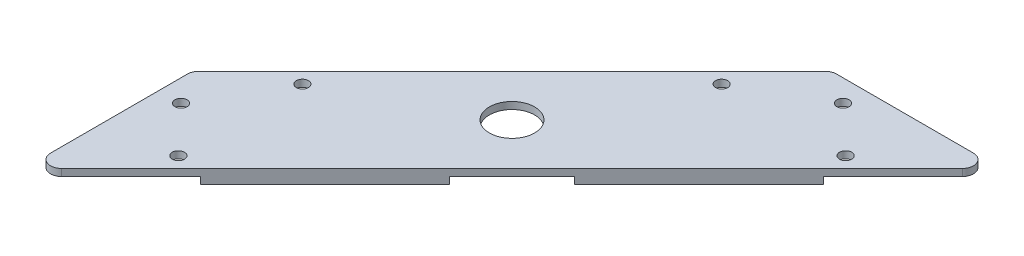
from build123d import *

# Parameters (mm, degrees)
SKETCH1_R           = 10.25
BOSS_EXTRUDE1_DEPTH = 3.175
BOSS_EXTRUDE2_DEPTH = 3.175
FILLET1_R           = 5
CUT_EXTRUDE1_REACH  = 260.624
SKETCH3_R           = 2.75


with BuildPart() as part:
    # Sketch1 → Boss-Extrude1 (new body)
    with BuildSketch(Plane(origin=(0, 0, 0), x_dir=(1, 0, 0), z_dir=(0, 1, 0))):
        Polygon((0, 0), (76.2, 0), (-145, -221.2), (-145, -145), align=None)
        with Locations(Location((-53.45, -91.55, 0), (0, 0, 270))):
            Circle(SKETCH1_R, mode=Mode.SUBTRACT)
    extrude(amount=BOSS_EXTRUDE1_DEPTH)

    # Sketch2 → Boss-Extrude2 (add)
    with BuildSketch(Plane.XZ):
        Polygon((-20.257864376, 96.457864376), (-58.357864376, 58.357864376), (-40, 40), (36.2, 40), align=None)
        Polygon((-105, 105), (-86.642135624, 86.642135624), (-48.542135624, 124.742135624), (-105, 181.2), align=None)
    extrude(amount=BOSS_EXTRUDE2_DEPTH)

    # Fillet1
    fillet1_edges = [part.edges().sort_by_distance(p)[0] for p in [
        (0, 1.5875, 0),
        (76.2, 1.5875, 0),
        (-145, 1.5875, 221.2),
        (-145, 1.5875, 145),
    ]]
    fillet(fillet1_edges, radius=FILLET1_R)

    # Sketch3 → Cut-Extrude1 (cut, up to next)
    with BuildSketch(Plane(origin=(0, 0, 0), x_dir=(-1, 0, 0), z_dir=(0, -1, 0)), mode=Mode.PRIVATE) as cut_extrude1_sk1:
        with Locations(Location((115, -125, 0), (0, 0, 90))):
            Circle(SKETCH3_R)
    cut_extrude1_tool1 = extrude(cut_extrude1_sk1.sketch, amount=-CUT_EXTRUDE1_REACH, mode=Mode.PRIVATE) & part.part
    # Sketch3 → Cut-Extrude1 (cut, up to next)
    with BuildSketch(Plane(origin=(0, 0, 0), x_dir=(-1, 0, 0), z_dir=(0, -1, 0)), mode=Mode.PRIVATE) as cut_extrude1_sk2:
        with Locations(Location((115, -181.2, 0), (0, 0, 90))):
            Circle(SKETCH3_R)
    cut_extrude1_tool2 = extrude(cut_extrude1_sk2.sketch, amount=-CUT_EXTRUDE1_REACH, mode=Mode.PRIVATE) & part.part
    # Sketch3 → Cut-Extrude1 (cut, up to next)
    with BuildSketch(Plane(origin=(0, 0, 0), x_dir=(-1, 0, 0), z_dir=(0, -1, 0)), mode=Mode.PRIVATE) as cut_extrude1_sk3:
        with Locations(Location((135, -160, 0), (0, 0, 90))):
            Circle(SKETCH3_R)
    cut_extrude1_tool3 = extrude(cut_extrude1_sk3.sketch, amount=-CUT_EXTRUDE1_REACH, mode=Mode.PRIVATE) & part.part
    # Sketch3 → Cut-Extrude1 (cut, up to next)
    with BuildSketch(Plane(origin=(0, 0, 0), x_dir=(-1, 0, 0), z_dir=(0, -1, 0)), mode=Mode.PRIVATE) as cut_extrude1_sk4:
        with Locations(Location((-15, -10, 0), (0, 0, 90))):
            Circle(SKETCH3_R)
    cut_extrude1_tool4 = extrude(cut_extrude1_sk4.sketch, amount=-CUT_EXTRUDE1_REACH, mode=Mode.PRIVATE) & part.part
    # Sketch3 → Cut-Extrude1 (cut, up to next)
    with BuildSketch(Plane(origin=(0, 0, 0), x_dir=(-1, 0, 0), z_dir=(0, -1, 0)), mode=Mode.PRIVATE) as cut_extrude1_sk5:
        with Locations(Location((-36.2, -30, 0), (0, 0, 90))):
            Circle(SKETCH3_R)
    cut_extrude1_tool5 = extrude(cut_extrude1_sk5.sketch, amount=-CUT_EXTRUDE1_REACH, mode=Mode.PRIVATE) & part.part
    # Sketch3 → Cut-Extrude1 (cut, up to next)
    with BuildSketch(Plane(origin=(0, 0, 0), x_dir=(-1, 0, 0), z_dir=(0, -1, 0)), mode=Mode.PRIVATE) as cut_extrude1_sk6:
        with Locations(Location((20, -30, 0), (0, 0, 90))):
            Circle(SKETCH3_R)
    cut_extrude1_tool6 = extrude(cut_extrude1_sk6.sketch, amount=-CUT_EXTRUDE1_REACH, mode=Mode.PRIVATE) & part.part
    add(cut_extrude1_tool1.solids().sort_by_distance((-115, 0, 125))[0], mode=Mode.SUBTRACT)
    add(cut_extrude1_tool2.solids().sort_by_distance((-115, 0, 181.2))[0], mode=Mode.SUBTRACT)
    add(cut_extrude1_tool3.solids().sort_by_distance((-135, 0, 160))[0], mode=Mode.SUBTRACT)
    add(cut_extrude1_tool4.solids().sort_by_distance((15, 0, 10))[0], mode=Mode.SUBTRACT)
    add(cut_extrude1_tool5.solids().sort_by_distance((36.2, 0, 30))[0], mode=Mode.SUBTRACT)
    add(cut_extrude1_tool6.solids().sort_by_distance((-20, 0, 30))[0], mode=Mode.SUBTRACT)


solid = part.part
